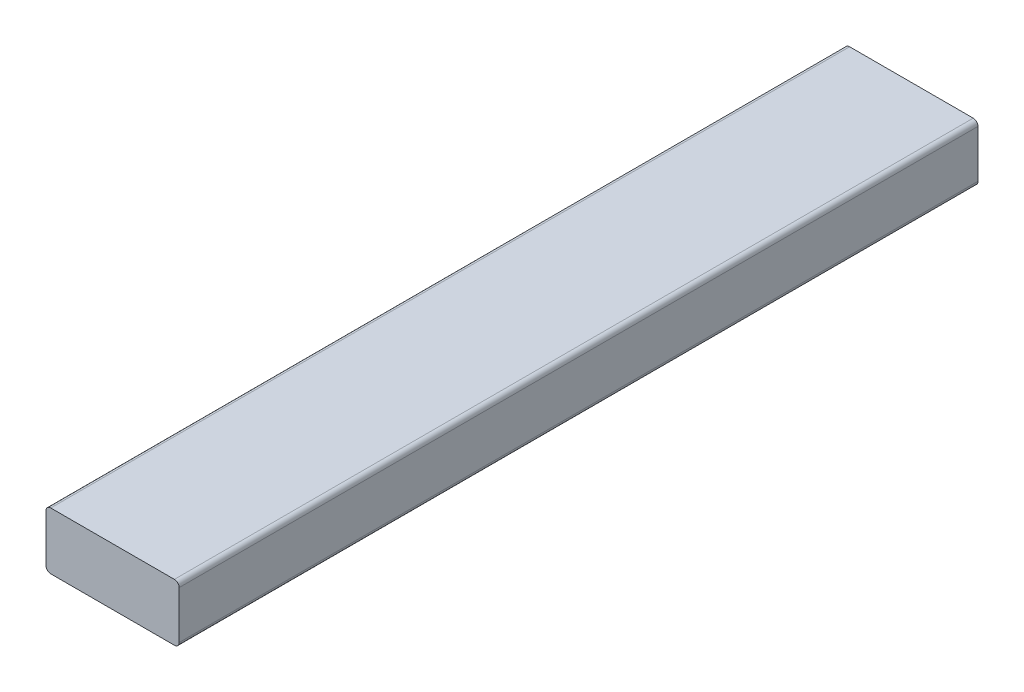
from build123d import *

# Parameters (mm, degrees)
SKETCH1_W           = 88.9
SKETCH1_H           = 38.1
BOSS_EXTRUDE1_DEPTH = 533.4
FILLET1_R           = 3.175


with BuildPart() as part:
    # Sketch1 → Boss-Extrude1 (new body)
    with BuildSketch(Plane.XY):
        Rectangle(SKETCH1_W, SKETCH1_H)
    extrude(amount=BOSS_EXTRUDE1_DEPTH)

    # Fillet1
    fillet1_edges = [part.edges().sort_by_distance(p)[0] for p in [
        (44.45, -19.05, 266.7),
        (-44.45, -19.05, 266.7),
        (-44.45, 19.05, 266.7),
        (44.45, 19.05, 266.7),
    ]]
    fillet(fillet1_edges, radius=FILLET1_R)


solid = part.part
